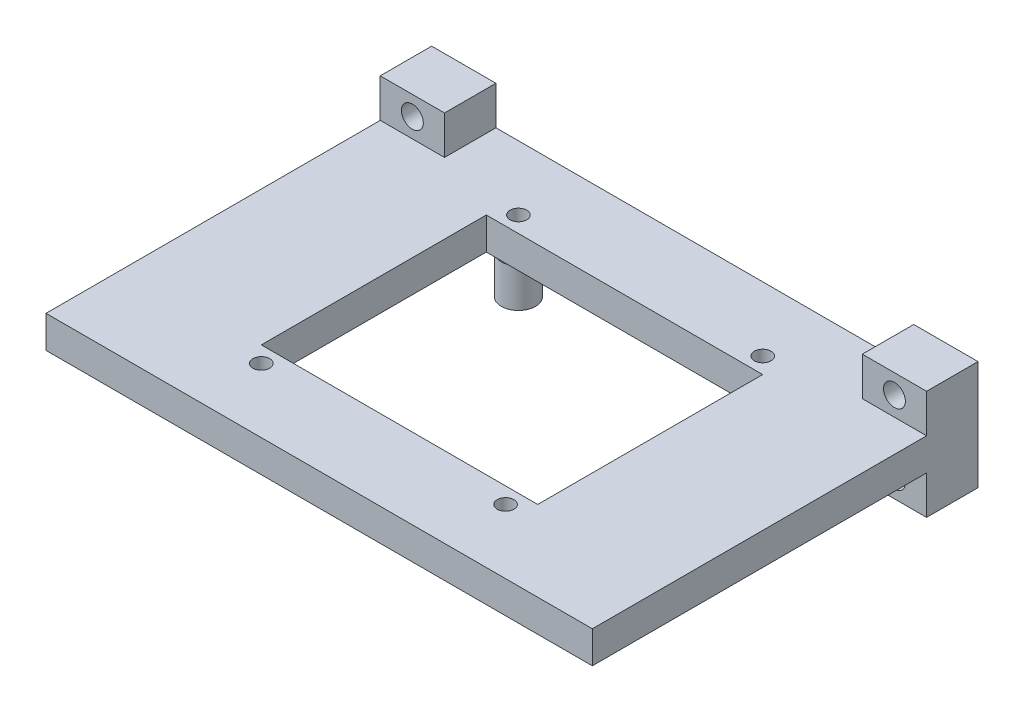
from build123d import *

# Parameters (mm, degrees)
SKETCH3_W           = 85
SKETCH3_H           = 60
BOSS_EXTRUDE3_DEPTH = 5
SKETCH5_W           = 43
SKETCH5_H           = 35
CUT_EXTRUDE2_DEPTH  = 10
CUT_EXTRUDE1_REACH  = 75.58
SKETCH4_R           = 1.3
SKETCH9_R           = 2.65
SKETCH9_R_2         = 1.05
BOSS_EXTRUDE5_DEPTH = 6
SKETCH10_W          = 10
SKETCH10_H          = 6
SKETCH10_R          = 1.7
BOSS_EXTRUDE6_DEPTH = 8


with BuildPart() as part:
    # Sketch3 → Boss-Extrude3 (new body)
    with BuildSketch(Plane(origin=(0, 0, 0), x_dir=(1, 0, 0), z_dir=(0, 1, 0))):
        with Locations((-24.5, 0)):
            Rectangle(SKETCH3_W, SKETCH3_H)
    extrude(amount=BOSS_EXTRUDE3_DEPTH)

    # Sketch5 → Cut-Extrude2 (cut)
    with BuildSketch(Plane.XZ):
        with Locations((-24.5, 0)):
            Rectangle(SKETCH5_W, SKETCH5_H)
    extrude(amount=-CUT_EXTRUDE2_DEPTH, mode=Mode.SUBTRACT)

    # Sketch4 → Cut-Extrude1 (cut, up to next)
    with BuildSketch(Plane(origin=(0, 5, 0), x_dir=(1, 0, 0), z_dir=(0, 1, 0)), mode=Mode.PRIVATE) as cut_extrude1_sk1:
        with Locations(Location((-43.5, 20, 0), (0, 0, 270))):
            Circle(SKETCH4_R)
    cut_extrude1_tool1 = extrude(cut_extrude1_sk1.sketch, amount=-CUT_EXTRUDE1_REACH, mode=Mode.PRIVATE) & part.part
    # Sketch4 → Cut-Extrude1 (cut, up to next)
    with BuildSketch(Plane(origin=(0, 5, 0), x_dir=(1, 0, 0), z_dir=(0, 1, 0)), mode=Mode.PRIVATE) as cut_extrude1_sk2:
        with Locations(Location((-5.5, 20, 0), (0, 0, 270))):
            Circle(SKETCH4_R)
    cut_extrude1_tool2 = extrude(cut_extrude1_sk2.sketch, amount=-CUT_EXTRUDE1_REACH, mode=Mode.PRIVATE) & part.part
    # Sketch4 → Cut-Extrude1 (cut, up to next)
    with BuildSketch(Plane(origin=(0, 5, 0), x_dir=(1, 0, 0), z_dir=(0, 1, 0)), mode=Mode.PRIVATE) as cut_extrude1_sk3:
        with Locations(Location((-5.5, -20, 0), (0, 0, 270))):
            Circle(SKETCH4_R)
    cut_extrude1_tool3 = extrude(cut_extrude1_sk3.sketch, amount=-CUT_EXTRUDE1_REACH, mode=Mode.PRIVATE) & part.part
    # Sketch4 → Cut-Extrude1 (cut, up to next)
    with BuildSketch(Plane(origin=(0, 5, 0), x_dir=(1, 0, 0), z_dir=(0, 1, 0)), mode=Mode.PRIVATE) as cut_extrude1_sk4:
        with Locations(Location((-43.5, -20, 0), (0, 0, 270))):
            Circle(SKETCH4_R)
    cut_extrude1_tool4 = extrude(cut_extrude1_sk4.sketch, amount=-CUT_EXTRUDE1_REACH, mode=Mode.PRIVATE) & part.part
    add(cut_extrude1_tool1.solids().sort_by_distance((-43.5, 5, -20))[0], mode=Mode.SUBTRACT)
    add(cut_extrude1_tool2.solids().sort_by_distance((-5.5, 5, -20))[0], mode=Mode.SUBTRACT)
    add(cut_extrude1_tool3.solids().sort_by_distance((-5.5, 5, 20))[0], mode=Mode.SUBTRACT)
    add(cut_extrude1_tool4.solids().sort_by_distance((-43.5, 5, 20))[0], mode=Mode.SUBTRACT)

    # Sketch9 → Boss-Extrude5 (add)
    # profile 1 of 4: a face of its own
    with BuildSketch(Plane.XZ):
        with Locations(Location((-43.5, 20, 0), (0, 0, 250.629961754))):
            Circle(SKETCH9_R)
        with Locations(Location((-43.5, 20, 0), (0, 0, 270))):
            Circle(SKETCH9_R_2, mode=Mode.SUBTRACT)
    # profile 2 of 4: a face of its own
    with BuildSketch(Plane.XZ):
        with Locations(Location((-43.5, -20, 0), (0, 0, 109.370038246))):
            Circle(SKETCH9_R)
        with Locations(Location((-43.5, -20, 0), (0, 0, 270))):
            Circle(SKETCH9_R_2, mode=Mode.SUBTRACT)
    # profile 3 of 4: a face of its own
    with BuildSketch(Plane.XZ):
        with Locations(Location((-5.5, 20, 0), (0, 0, 250.629961754))):
            Circle(SKETCH9_R)
        with Locations(Location((-5.5, 20, 0), (0, 0, 270))):
            Circle(SKETCH9_R_2, mode=Mode.SUBTRACT)
    # profile 4 of 4: a face of its own
    with BuildSketch(Plane.XZ):
        with Locations(Location((-5.5, -20, 0), (0, 0, 109.370038246))):
            Circle(SKETCH9_R)
        with Locations(Location((-5.5, -20, 0), (0, 0, 270))):
            Circle(SKETCH9_R_2, mode=Mode.SUBTRACT)
    extrude(amount=BOSS_EXTRUDE5_DEPTH)

    # Sketch10 → Boss-Extrude6 (add)
    # profile 1 of 4: a face of its own
    with BuildSketch(Plane(origin=(-17, 0, -30), x_dir=(-1, 0, 0), z_dir=(0, 0, -1))):
        with Locations((-30, -3)):
            Rectangle(SKETCH10_W, SKETCH10_H)
        with Locations((-30, -3)):
            Circle(SKETCH10_R, mode=Mode.SUBTRACT)
    # profile 2 of 4: a face of its own
    with BuildSketch(Plane(origin=(-17, 0, -30), x_dir=(-1, 0, 0), z_dir=(0, 0, -1))):
        with Locations((45, -3)):
            Rectangle(SKETCH10_W, SKETCH10_H)
        with Locations(Location((45, -3, 0), (0, 0, 180))):
            Circle(SKETCH10_R, mode=Mode.SUBTRACT)
    # profile 3 of 4: a face of its own
    with BuildSketch(Plane(origin=(-17, 0, -30), x_dir=(-1, 0, 0), z_dir=(0, 0, -1))):
        with Locations((45, 8)):
            Rectangle(SKETCH10_W, SKETCH10_H)
        with Locations((45, 8)):
            Circle(SKETCH10_R, mode=Mode.SUBTRACT)
    # profile 4 of 4: a face of its own
    with BuildSketch(Plane(origin=(-17, 0, -30), x_dir=(-1, 0, 0), z_dir=(0, 0, -1))):
        with Locations((-30, 8)):
            Rectangle(SKETCH10_W, SKETCH10_H)
        with Locations(Location((-30, 8, 0), (0, 0, 180))):
            Circle(SKETCH10_R, mode=Mode.SUBTRACT)
    extrude(amount=-BOSS_EXTRUDE6_DEPTH)


solid = part.part
